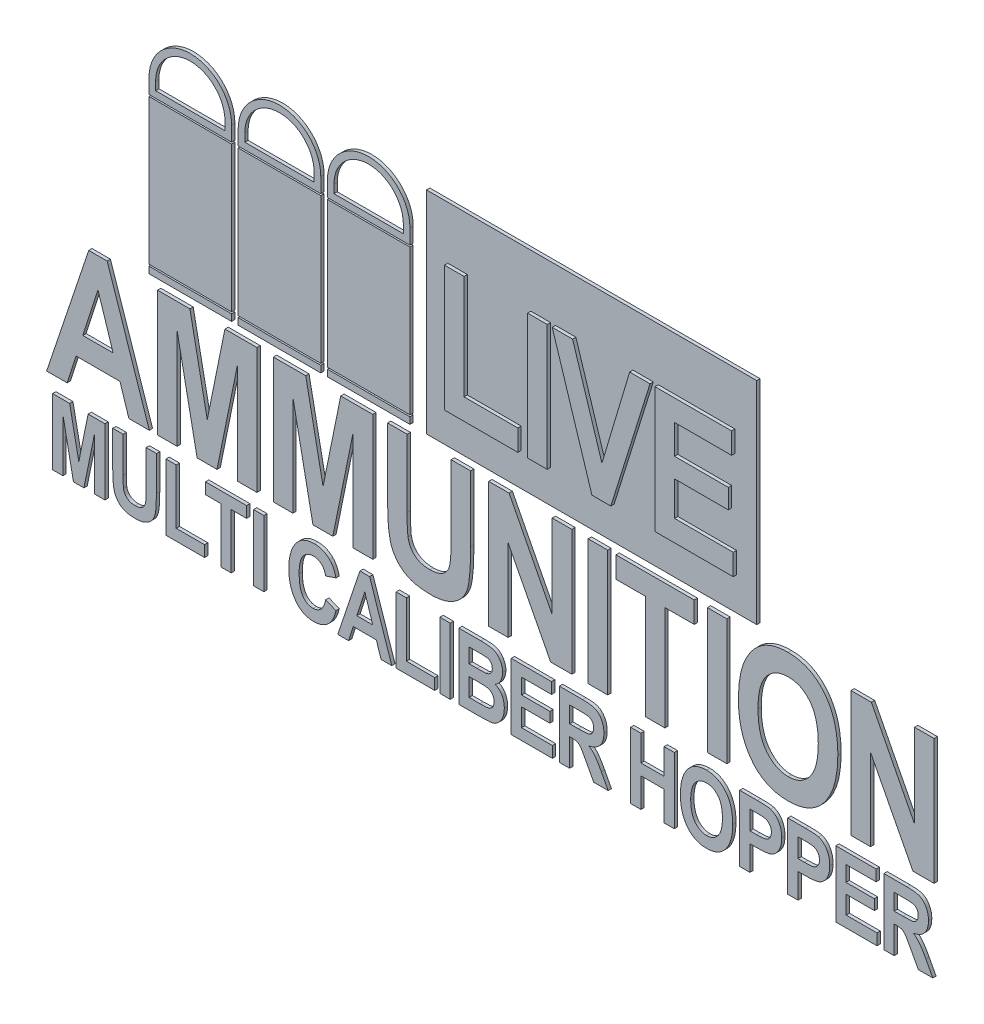
from build123d import *

# Parameters (mm, degrees)
BOSS_EXTRUDE1_DEPTH   = 1
SKETCH2_W             = 25
SKETCH2_H             = 44
BOSS_EXTRUDE1_2_DEPTH = 1
SKETCH2_H_2           = 2
BOSS_EXTRUDE1_3_DEPTH = 1
LPATTERN1_COUNT       = 3
LPATTERN1_PITCH       = 27
SKETCH3_W             = 100
SKETCH3_H             = 64
BOSS_EXTRUDE2_DEPTH   = 1
SKETCH4_W             = 5.922077922
SKETCH4_H             = 38
SKETCH4_W_2           = 3.116883117
SKETCH4_H_2           = 20
BOSS_EXTRUDE3_DEPTH   = 1
SCALE1_SCALE          = 0.6


with BuildPart() as part:
    # Sketch2 → Boss-Extrude1 (new body)
    with BuildSketch(Plane.XY):
        with BuildLine():
            ThreePointArc((-12.5, 51.5), (0, 64), (12.5, 51.5))
            Line((12.5, 51.5), (12.5, 47))
            Line((12.5, 47), (-12.5, 47))
            Line((-12.5, 47), (-12.5, 51.5))
        make_face()
        with BuildLine():
            ThreePointArc((10.5, 51.5), (0, 62), (-10.5, 51.5))
            Line((-10.5, 51.5), (-10.5, 49))
            Line((-10.5, 49), (10.5, 49))
            Line((10.5, 49), (10.5, 51.5))
        make_face(mode=Mode.SUBTRACT)
    extrude(amount=BOSS_EXTRUDE1_DEPTH)


with BuildPart() as body_2:
    # Sketch2 → Boss-Extrude1 2 (new body)
    with BuildSketch(Plane.XY):
        with Locations((0, 24.5)):
            Rectangle(SKETCH2_W, SKETCH2_H)
    extrude(amount=BOSS_EXTRUDE1_2_DEPTH)


with BuildPart() as body_3:
    # Sketch2 → Boss-Extrude1 3 (new body)
    with BuildSketch(Plane.XY):
        with Locations((0, 1)):
            Rectangle(SKETCH2_W, SKETCH2_H_2)
    extrude(amount=BOSS_EXTRUDE1_3_DEPTH)


with BuildPart() as lpattern1_1:
    # LPattern1: pattern copy
    add(body_3.part.moved(Location(Vector(1, 0, 0) * (1 * LPATTERN1_PITCH))))


with BuildPart() as lpattern1_2:
    # LPattern1: pattern copy
    add(body_3.part.moved(Location(Vector(1, 0, 0) * (2 * LPATTERN1_PITCH))))


with BuildPart() as lpattern1_3:
    # LPattern1: pattern copy
    add(body_2.part.moved(Location(Vector(1, 0, 0) * (1 * LPATTERN1_PITCH))))


with BuildPart() as lpattern1_4:
    # LPattern1: pattern copy
    add(body_2.part.moved(Location(Vector(1, 0, 0) * (2 * LPATTERN1_PITCH))))


with BuildPart() as lpattern1_5:
    # LPattern1: pattern copy
    add(part.part.moved(Location(Vector(1, 0, 0) * (1 * LPATTERN1_PITCH))))


with BuildPart() as lpattern1_6:
    # LPattern1: pattern copy
    add(part.part.moved(Location(Vector(1, 0, 0) * (2 * LPATTERN1_PITCH))))


with BuildPart() as body_10:
    # Sketch3 → Boss-Extrude2 (new body)
    with BuildSketch(Plane.XY):
        with Locations((121.5, 32)):
            Rectangle(SKETCH3_W, SKETCH3_H)
    extrude(amount=BOSS_EXTRUDE2_DEPTH)

    # Sketch4 → Boss-Extrude3 (add)
    # profile 1 of 32: a face of its own
    with BuildSketch(Plane.XY.offset(1)):
        Polygon((77.954545455, 10), (77.954545455, 48), (83.876623377, 48), (83.876623377, 16.415584416), (100.162337662, 16.415584416), (100.162337662, 10), align=None)
    # profile 2 of 32: a face of its own
    with BuildSketch(Plane.XY.offset(1)):
        with Locations((106.109090909, 29)):
            Rectangle(SKETCH4_W, SKETCH4_H)
    # profile 3 of 32: a face of its own
    with BuildSketch(Plane.XY.offset(1)):
        Polygon((122.596834416, 10), (110.575324675, 48), (116.736444805, 48), (125.627272727, 19.877840909), (134.024594156, 48), (140.185714286, 48), (128.318425325, 10), align=None)
    # profile 4 of 32: a face of its own
    with BuildSketch(Plane.XY.offset(1)):
        Polygon((141.690909091, 10), (141.690909091, 48), (164.885714286, 48), (164.885714286, 41.584415584), (147.612987013, 41.584415584), (147.612987013, 32.701298701), (163.898701299, 32.701298701), (163.898701299, 26.779220779), (147.612987013, 26.779220779), (147.612987013, 16.415584416), (165.379220779, 16.415584416), (165.379220779, 10), align=None)
    # profile 5 of 32: a face of its own
    with BuildSketch(Plane.XY.offset(1)):
        Polygon((-11.409090909, -40), (-17.593344156, -40), (-20.299918831, -31.61038961), (-33.601461039, -31.61038961), (-36.300324675, -40), (-42.5, -40), (-29.753652597, -2), (-24.178571429, -2), align=None)
        Polygon((-22.366477273, -25.194805195), (-26.954545455, -10.952516234), (-31.542613636, -25.194805195), align=None, mode=Mode.SUBTRACT)
    # profile 6 of 32: a face of its own
    with BuildSketch(Plane.XY.offset(1)):
        Polygon((-8.916883117, -40), (-8.916883117, -2), (0.883847403, -2), (6.135064935, -28.418019481), (11.486525974, -2), (21.187012987, -2), (21.187012987, -40), (15.264935065, -40), (15.264935065, -9.595373377), (9.088392857, -40), (3.066071429, -40), (-2.994805195, -9.595373377), (-2.994805195, -40), align=None)
    # profile 7 of 32: a face of its own
    with BuildSketch(Plane.XY.offset(1)):
        Polygon((26.146753247, -40), (26.146753247, -2), (35.947483766, -2), (41.198701299, -28.418019481), (46.550162338, -2), (56.250649351, -2), (56.250649351, -40), (50.328571429, -40), (50.328571429, -9.595373377), (44.152029221, -40), (38.129707792, -40), (32.068831169, -9.595373377), (32.068831169, -40), align=None)
    # profile 8 of 32: a face of its own
    with BuildSketch(Plane.XY.offset(1)):
        with BuildLine():
            Line((60.716883117, -2), (66.638961039, -2))
            Line((66.638961039, -2), (66.638961039, -22.573051948))
            add(Edge.make_bspline(
                [(66.638961039, -22.573051948), (66.642005268, -22.95602488), (66.647807706, -23.685988415), (66.648717001, -24.727180144), (66.678354301, -25.662591623), (66.695134236, -26.495778316), (66.73384583, -27.225945133), (66.783458622, -27.850035243), (66.821023479, -28.371076106), (66.871025542, -28.680416205), (66.893425325, -28.818993506)],
                knots=[0, 0, 0, 0, 1.469285763, 2.800524371, 3.994042537, 5.059414993, 5.997483402, 6.798392936, 7.46170747, 8, 8, 8, 8], degree=3))
            add(Edge.make_bspline(
                [(66.893425325, -28.818993506), (66.979166694, -29.219308088), (67.144643006, -29.991894068), (67.6229785, -31.047092181), (68.233530785, -31.972335327), (69.020403144, -32.735497922), (69.948723069, -33.349024699), (71.027563274, -33.76613137), (72.231423983, -34.038505141), (73.081187567, -34.064400163), (73.524918831, -34.077922078)],
                knots=[0, 0, 0, 0, 1.05227666, 2.030838329, 2.965952682, 3.893387552, 4.835862824, 5.813729276, 6.85836874, 8, 8, 8, 8], degree=3))
            add(Edge.make_bspline(
                [(73.524918831, -34.077922078), (73.901060524, -34.067332539), (74.622333142, -34.04702651), (75.647027209, -33.859382251), (76.567318217, -33.560638461), (77.376058468, -33.135217387), (78.069702434, -32.597051532), (78.652679687, -31.96315057), (79.109498325, -31.230292316), (79.392833188, -30.535103545), (79.564371344, -29.885872955), (79.665222592, -29.265772929), (79.756856213, -28.524945726), (79.83183982, -27.660643738), (79.891783079, -26.673301192), (79.939201793, -25.56278164), (79.959055079, -24.328672735), (79.962061626, -23.464965079), (79.963636364, -23.012581169)],
                knots=[0, 0, 0, 0, 1.210192899, 2.320612201, 3.341352725, 4.315073608, 5.247135226, 6.155185472, 7.073736358, 8.012826977, 8.56089637, 9.233084862, 10.033819608, 10.964483777, 12.025952736, 13.21881392, 14.543298968, 16, 16, 16, 16], degree=3))
            Line((79.963636364, -23.012581169), (79.963636364, -2))
            Line((79.963636364, -2), (85.885714286, -2))
            Line((85.885714286, -2), (85.885714286, -21.879058442))
            add(Edge.make_bspline(
                [(85.885714286, -21.879058442), (85.882438829, -22.490825448), (85.876107446, -23.67335683), (85.836780705, -25.380246628), (85.779321524, -26.95647441), (85.685997305, -28.398716052), (85.571199671, -29.709992942), (85.438795641, -30.889209268), (85.265945142, -31.935324958), (85.079448072, -32.86800006), (84.832463878, -33.715634463), (84.536453033, -34.51108676), (84.163275661, -35.260712571), (83.726685692, -35.97010385), (83.226943882, -36.639314775), (82.659215005, -37.269320059), (82.023848279, -37.853737777), (81.33147001, -38.402962905), (80.577099131, -38.896807533), (79.75992387, -39.322710924), (78.886855099, -39.683178856), (77.957314435, -39.9867974), (76.968848959, -40.216198039), (75.921991083, -40.374557352), (74.819922852, -40.478969111), (74.064940216, -40.488590107), (73.67913961, -40.493506494)],
                knots=[0, 0, 0, 0, 1.69941726, 3.284934, 4.742645532, 6.080601134, 7.299143691, 8.399121829, 9.375758488, 10.243985084, 11.039399806, 11.825790082, 12.59854505, 13.361473367, 14.136895684, 14.91546747, 15.713761241, 16.532267381, 17.368001279, 18.214343285, 19.088188771, 19.989122623, 20.927829205, 21.903342887, 22.928595776, 24, 24, 24, 24], degree=3))
            add(Edge.make_bspline(
                [(73.67913961, -40.493506494), (73.278067847, -40.486496923), (72.500878229, -40.472913905), (71.36761428, -40.399260152), (70.301789522, -40.259849097), (69.303098702, -40.067849734), (68.367697218, -39.832242428), (67.504464241, -39.530675085), (66.705231255, -39.178198563), (65.976985602, -38.762752512), (65.298434087, -38.310346173), (64.687387974, -37.792118638), (64.098087726, -37.258170701), (63.579000614, -36.658191563), (63.093513659, -36.023428335), (62.666615784, -35.339862185), (62.285101972, -34.612022446), (61.936037783, -33.827923432), (61.635393686, -32.931351819), (61.399421905, -31.883560243), (61.184474075, -30.674466021), (61.007837506, -29.297892075), (60.885740398, -27.756187935), (60.780721636, -26.049425521), (60.733603892, -24.174630707), (60.722614704, -22.868653409), (60.716883117, -22.1875)],
                knots=[0, 0, 0, 0, 1.101276875, 2.134034431, 3.11617034, 4.050409819, 4.925069176, 5.762018322, 6.55810086, 7.319651782, 8.061491943, 8.793396749, 9.517399564, 10.242364782, 10.96784505, 11.709920146, 12.451760307, 13.222767815, 14.064108867, 15.04322293, 16.168677574, 17.435293046, 18.851812183, 20.414137798, 22.129736046, 24, 24, 24, 24], degree=3))
            Line((60.716883117, -22.1875), (60.716883117, -2))
        make_face()
    # profile 9 of 32: a face of its own
    with BuildSketch(Plane.XY.offset(1)):
        Polygon((91.338961039, -40), (91.338961039, -2), (97.523214286, -2), (110.585714286, -27.377029221), (110.585714286, -2), (116.507792208, -2), (116.507792208, -40), (110.10762987, -40), (97.261038961, -15.216720779), (97.261038961, -40), align=None)
    # profile 10 of 32: a face of its own
    with BuildSketch(Plane.XY.offset(1)):
        with Locations((124.428571429, -21)):
            Rectangle(SKETCH4_W, SKETCH4_H)
    # profile 11 of 32: a face of its own
    with BuildSketch(Plane.XY.offset(1)):
        Polygon((138.764935065, -40), (138.764935065, -8.415584416), (129.881818182, -8.415584416), (129.881818182, -2), (153.57012987, -2), (153.57012987, -8.415584416), (144.687012987, -8.415584416), (144.687012987, -40), align=None)
    # profile 12 of 32: a face of its own
    with BuildSketch(Plane.XY.offset(1)):
        with Locations((160.503896104, -21)):
            Rectangle(SKETCH4_W, SKETCH4_H)
    # profile 13 of 32: a face of its own
    with BuildSketch(Plane.XY.offset(1)):
        with BuildLine():
            add(Edge.make_bspline(
                [(166.944155844, -21.231331169), (166.949720896, -20.681129056), (166.960599192, -19.605620325), (167.05581385, -18.03126164), (167.204498606, -16.530043966), (167.432851849, -15.105908144), (167.701991073, -13.751365116), (168.056290948, -12.477509773), (168.448242745, -11.269530004), (168.926254621, -10.144384545), (169.439959414, -9.084242464), (170.00365531, -8.100663001), (170.599182149, -7.18076565), (171.239243216, -6.33600329), (171.910642098, -5.552435624), (172.618949883, -4.839680533), (173.374229941, -4.206209489), (174.161185506, -3.630052553), (174.996023808, -3.129368388), (175.871890345, -2.697834091), (176.784890263, -2.323759432), (177.744649461, -2.023080047), (178.748561441, -1.795260613), (179.793620985, -1.623642542), (180.881109724, -1.522105827), (181.62061996, -1.511751091), (181.996103896, -1.506493506)],
                knots=[0, 0, 0, 0, 1.413007263, 2.762078904, 4.049593578, 5.285819603, 6.465306206, 7.594367978, 8.679938674, 9.724528792, 10.731323562, 11.704103677, 12.63428548, 13.544001443, 14.424033479, 15.282963126, 16.12148102, 16.953398054, 17.7855508, 18.618122424, 19.459105522, 20.317248336, 21.19802291, 22.101006911, 23.035792388, 24, 24, 24, 24], degree=3))
            add(Edge.make_bspline(
                [(181.996103896, -1.506493506), (182.539409951, -1.519914933), (183.605805093, -1.546258363), (185.164231285, -1.794797409), (186.648175118, -2.184234547), (188.054206649, -2.743573622), (189.379732994, -3.466776008), (190.628205424, -4.34465588), (191.800079091, -5.378422069), (192.884538285, -6.568039095), (193.874470835, -7.897637843), (194.722962641, -9.379369447), (195.451358558, -10.986335238), (196.031733973, -12.735627375), (196.497642609, -14.611622392), (196.810123654, -16.624668148), (197.020158968, -18.767045388), (197.03857345, -20.241204924), (197.048051948, -21)],
                knots=[0, 0, 0, 0, 0.939885583, 1.844797075, 2.724414307, 3.591141889, 4.457241096, 5.332435845, 6.227757785, 7.156796134, 8.114335849, 9.091188046, 10.106791572, 11.163484353, 12.277169456, 13.449020478, 14.686932687, 16, 16, 16, 16], degree=3))
            add(Edge.make_bspline(
                [(197.048051948, -21), (197.035422612, -21.766457516), (197.010792844, -23.261205268), (196.799524561, -25.438729004), (196.45720144, -27.488831812), (195.973219681, -29.40895746), (195.348255009, -31.201294064), (194.583284644, -32.864681486), (193.686500852, -34.408179477), (192.964286045, -35.332068659), (192.606493506, -35.789772727)],
                knots=[0, 0, 0, 0, 1.16723241, 2.276340154, 3.328694564, 4.330478862, 5.288855569, 6.215552891, 7.11596681, 8, 8, 8, 8], degree=3))
            add(Edge.make_bspline(
                [(192.606493506, -35.789772727), (192.275560927, -36.165528258), (191.622767781, -36.906738552), (190.506552036, -37.867095319), (189.308150815, -38.684019557), (188.014517476, -39.340140033), (186.640444662, -39.862241627), (185.176267028, -40.231004659), (183.624470151, -40.447598455), (182.562272323, -40.477976235), (182.019237013, -40.493506494)],
                knots=[0, 0, 0, 0, 1.001181491, 1.974917111, 2.938062765, 3.897505349, 4.871145834, 5.87433439, 6.913280131, 8, 8, 8, 8], degree=3))
            add(Edge.make_bspline(
                [(182.019237013, -40.493506494), (181.470862129, -40.482442515), (180.400114548, -40.460839177), (178.840896277, -40.226127593), (177.367960816, -39.870473729), (175.985658566, -39.358731025), (174.693640649, -38.698728547), (173.495572426, -37.888018562), (172.36741653, -36.948533387), (171.715868083, -36.210179145), (171.385714286, -35.836038961)],
                knots=[0, 0, 0, 0, 1.094964679, 2.13800963, 3.143281602, 4.118328618, 5.076193384, 6.03488399, 7.004232895, 8, 8, 8, 8], degree=3))
            add(Edge.make_bspline(
                [(171.385714286, -35.836038961), (171.028489925, -35.377984342), (170.310142443, -34.456875875), (169.408458999, -32.927164331), (168.643877382, -31.278640303), (168.021562144, -29.506180337), (167.534442829, -27.612626578), (167.193331096, -25.595578831), (166.981230873, -23.454086801), (166.9567261, -21.984954508), (166.944155844, -21.231331169)],
                knots=[0, 0, 0, 0, 0.894191496, 1.798142236, 2.728299874, 3.690218715, 4.688169272, 5.737002699, 6.839146352, 8, 8, 8, 8], degree=3))
        make_face()
        with BuildLine():
            add(Edge.make_bspline(
                [(172.866233766, -20.976866883), (172.872496762, -21.506619697), (172.884615622, -22.531688271), (173.009845747, -24.017875697), (173.213905598, -25.402210915), (173.506956335, -26.685759593), (173.874408223, -27.868176394), (174.319146344, -28.952525361), (174.862251856, -29.92747997), (175.480496318, -30.801637411), (176.158079203, -31.571693775), (176.879532593, -32.240394208), (177.639908387, -32.810385825), (178.442320761, -33.273887469), (179.286392364, -33.634375973), (180.167334093, -33.885943171), (181.08806308, -34.047160312), (181.715257057, -34.067542391), (182.034659091, -34.077922078)],
                knots=[0, 0, 0, 0, 1.417627784, 2.743101411, 3.988491279, 5.160055516, 6.263228156, 7.299411243, 8.291037632, 9.243541693, 10.159958133, 11.031397084, 11.872096295, 12.698114263, 13.505705719, 14.322185685, 15.145563694, 16, 16, 16, 16], degree=3))
            add(Edge.make_bspline(
                [(182.034659091, -34.077922078), (182.356469955, -34.066597115), (182.988039863, -34.04437131), (183.915803373, -33.89715601), (184.798418503, -33.641608058), (185.638476165, -33.282042057), (186.439873044, -32.827174525), (187.186794371, -32.254608164), (187.904124029, -31.597778906), (188.56685117, -30.828302442), (189.177512572, -29.960136874), (189.705794487, -28.97692399), (190.140758613, -27.882999814), (190.501402709, -26.682892747), (190.786832768, -25.376125758), (190.980418928, -23.96057147), (191.108112422, -22.439171068), (191.119891328, -21.38840247), (191.125974026, -20.845779221)],
                knots=[0, 0, 0, 0, 0.856067668, 1.680075595, 2.491590685, 3.294271314, 4.105930429, 4.936043877, 5.792521075, 6.689215603, 7.631993153, 8.611021133, 9.650955643, 10.758472718, 11.941436728, 13.205325589, 14.55681326, 16, 16, 16, 16], degree=3))
            add(Edge.make_bspline(
                [(191.125974026, -20.845779221), (191.118699505, -20.313547104), (191.104588963, -19.281165168), (190.992819724, -17.786639829), (190.788926836, -16.402280899), (190.527853767, -15.123034638), (190.169136175, -13.953257445), (189.745445794, -12.883469245), (189.22348102, -11.930191571), (188.635726611, -11.080356303), (187.97767492, -10.340832455), (187.27155094, -9.695250936), (186.521246447, -9.143737456), (185.721600339, -8.688640954), (184.864999398, -8.352054018), (183.96548447, -8.106005346), (183.017284398, -7.942746628), (182.366927339, -7.929066908), (182.034659091, -7.922077922)],
                knots=[0, 0, 0, 0, 1.432762357, 2.779159561, 4.030754787, 5.197882272, 6.290139775, 7.320663351, 8.289843535, 9.209309419, 10.096549751, 10.948805523, 11.780590523, 12.598531546, 13.418314419, 14.250962417, 15.106414475, 16, 16, 16, 16], degree=3))
            add(Edge.make_bspline(
                [(182.034659091, -7.922077922), (181.702343483, -7.928927758), (181.051893725, -7.942335114), (180.101911366, -8.107979492), (179.196704106, -8.348074177), (178.34025547, -8.700251037), (177.532699978, -9.150649289), (176.772622914, -9.702933956), (176.060420696, -10.356156604), (175.396667172, -11.106166569), (174.786784787, -11.957340183), (174.275052166, -12.931071506), (173.835118799, -14.004890361), (173.480960588, -15.190944249), (173.208527898, -16.483578156), (173.010866374, -17.884986172), (172.884103356, -19.393771726), (172.872329631, -20.436824566), (172.866233766, -20.976866883)],
                knots=[0, 0, 0, 0, 0.8855316, 1.733273432, 2.565029, 3.379994694, 4.196545506, 5.026376759, 5.880638503, 6.769561942, 7.694238421, 8.666748973, 9.69692367, 10.785897995, 11.964055288, 13.217943305, 14.559585586, 16, 16, 16, 16], degree=3))
        make_face(mode=Mode.SUBTRACT)
    # profile 14 of 32: a face of its own
    with BuildSketch(Plane.XY.offset(1)):
        Polygon((201.020779221, -40), (201.020779221, -2), (207.205032468, -2), (220.267532468, -27.377029221), (220.267532468, -2), (226.18961039, -2), (226.18961039, -40), (219.789448052, -40), (206.942857143, -15.216720779), (206.942857143, -40), align=None)
    # profile 15 of 32: a face of its own
    with BuildSketch(Plane.XY.offset(1)):
        Polygon((-40.681818182, -65), (-40.681818182, -45), (-35.523538961, -45), (-32.75974026, -58.904220779), (-29.943181818, -45), (-24.837662338, -45), (-24.837662338, -65), (-27.954545455, -65), (-27.954545455, -48.997564935), (-31.205357143, -65), (-34.375, -65), (-37.564935065, -48.997564935), (-37.564935065, -65), align=None)
    # profile 16 of 32: a face of its own
    with BuildSketch(Plane.XY.offset(1)):
        with BuildLine():
            Line((-22.487012987, -45), (-19.37012987, -45))
            Line((-19.37012987, -45), (-19.37012987, -55.827922078))
            add(Edge.make_bspline(
                [(-19.37012987, -55.827922078), (-19.368527644, -56.029486779), (-19.36547373, -56.413678113), (-19.364995153, -56.96167376), (-19.349396574, -57.453995591), (-19.34056503, -57.892514903), (-19.320190507, -58.276813228), (-19.29407851, -58.605281707), (-19.274307534, -58.87951374), (-19.247990658, -59.042324318), (-19.236201299, -59.11525974)],
                knots=[0, 0, 0, 0, 1.469285763, 2.800524371, 3.994042537, 5.059414993, 5.997483402, 6.798392936, 7.46170747, 8, 8, 8, 8], degree=3))
            add(Edge.make_bspline(
                [(-19.236201299, -59.11525974), (-19.191074262, -59.325951625), (-19.103981467, -59.732575825), (-18.852225944, -60.287943253), (-18.530882635, -60.77491333), (-18.116739288, -61.176577854), (-17.628149854, -61.499486684), (-17.06033922, -61.71901651), (-16.426728321, -61.862371127), (-15.979484329, -61.876000086), (-15.745941558, -61.883116883)],
                knots=[0, 0, 0, 0, 1.05227666, 2.030838329, 2.965952682, 3.893387552, 4.835862824, 5.813729276, 6.85836874, 8, 8, 8, 8], degree=3))
            add(Edge.make_bspline(
                [(-15.745941558, -61.883116883), (-15.547972247, -61.877543442), (-15.168355079, -61.866856058), (-14.629042412, -61.768095921), (-14.144678724, -61.610862348), (-13.71902596, -61.38695652), (-13.353950189, -61.103711333), (-13.047120055, -60.770079248), (-12.806689193, -60.384364377), (-12.657565581, -60.01847555), (-12.567282341, -59.67677524), (-12.514202737, -59.350406805), (-12.465974515, -58.96049775), (-12.426509459, -58.505601967), (-12.394960375, -57.985947996), (-12.370003157, -57.401464021), (-12.359554059, -56.751933019), (-12.357971667, -56.297350042), (-12.357142857, -56.059253247)],
                knots=[0, 0, 0, 0, 1.210192899, 2.320612201, 3.341352725, 4.315073608, 5.247135226, 6.155185472, 7.073736358, 8.012826977, 8.56089637, 9.233084862, 10.033819608, 10.964483777, 12.025952736, 13.21881392, 14.543298968, 16, 16, 16, 16], degree=3))
            Line((-12.357142857, -56.059253247), (-12.357142857, -45))
            Line((-12.357142857, -45), (-9.24025974, -45))
            Line((-9.24025974, -45), (-9.24025974, -55.462662338))
            add(Edge.make_bspline(
                [(-9.24025974, -55.462662338), (-9.241983665, -55.784644973), (-9.245315972, -56.407029911), (-9.266014256, -57.305392962), (-9.296255931, -58.134986531), (-9.345373941, -58.89406108), (-9.405793748, -59.584206812), (-9.47548008, -60.204846983), (-9.566454026, -60.755434189), (-9.664610379, -61.246315821), (-9.79460206, -61.692439191), (-9.950397242, -62.111098295), (-10.146806385, -62.505638195), (-10.376590579, -62.879002026), (-10.639612584, -63.231218303), (-10.938417257, -63.562800031), (-11.272820796, -63.870388304), (-11.637230412, -64.159454161), (-12.034267716, -64.419372386), (-12.464359959, -64.643532065), (-12.923869838, -64.833252029), (-13.413101767, -64.993051263), (-13.933346754, -65.113788441), (-14.484324584, -65.197135448), (-15.064360495, -65.252089006), (-15.461719777, -65.257152688), (-15.664772727, -65.25974026)],
                knots=[0, 0, 0, 0, 1.69941726, 3.284934, 4.742645532, 6.080601134, 7.299143691, 8.399121829, 9.375758488, 10.243985084, 11.039399806, 11.825790082, 12.59854505, 13.361473367, 14.136895684, 14.91546747, 15.713761241, 16.532267381, 17.368001279, 18.214343285, 19.088188771, 19.989122623, 20.927829205, 21.903342887, 22.928595776, 24, 24, 24, 24], degree=3))
            add(Edge.make_bspline(
                [(-15.664772727, -65.25974026), (-15.875863129, -65.256051012), (-16.284910296, -65.248902055), (-16.881365006, -65.210136922), (-17.442325405, -65.136762683), (-17.967952153, -65.035710387), (-18.460268724, -64.911706541), (-18.914601869, -64.752986887), (-19.335250809, -64.567472928), (-19.718537995, -64.348817112), (-20.075670371, -64.110708512), (-20.397273589, -63.837957178), (-20.707431614, -63.556931948), (-20.980635357, -63.241153454), (-21.236154807, -62.907067545), (-21.460837899, -62.547295887), (-21.661634642, -62.16422234), (-21.845352636, -61.751538648), (-22.003586372, -61.279658852), (-22.127782046, -60.728189602), (-22.240912483, -60.091824222), (-22.333879098, -59.367311619), (-22.398140734, -58.555888387), (-22.453413766, -57.65759238), (-22.478212579, -56.670858267), (-22.483996362, -55.983501794), (-22.487012987, -55.625)],
                knots=[0, 0, 0, 0, 1.101276875, 2.134034431, 3.11617034, 4.050409819, 4.925069176, 5.762018322, 6.55810086, 7.319651782, 8.061491943, 8.793396749, 9.517399564, 10.242364782, 10.96784505, 11.709920146, 12.451760307, 13.222767815, 14.064108867, 15.04322293, 16.168677574, 17.435293046, 18.851812183, 20.414137798, 22.129736046, 24, 24, 24, 24], degree=3))
            Line((-22.487012987, -55.625), (-22.487012987, -45))
        make_face()
    # profile 17 of 32: a face of its own
    with BuildSketch(Plane.XY.offset(1)):
        Polygon((-6.37012987, -65), (-6.37012987, -45), (-3.253246753, -45), (-3.253246753, -61.623376623), (5.318181818, -61.623376623), (5.318181818, -65), align=None)
    # profile 18 of 32: a face of its own
    with BuildSketch(Plane.XY.offset(1)):
        Polygon((10.266233766, -65), (10.266233766, -48.376623377), (5.590909091, -48.376623377), (5.590909091, -45), (18.058441558, -45), (18.058441558, -48.376623377), (13.383116883, -48.376623377), (13.383116883, -65), align=None)
    # profile 19 of 32: a face of its own
    with BuildSketch(Plane.XY.offset(1)):
        with Locations((21.707792208, -55)):
            Rectangle(SKETCH4_W_2, SKETCH4_H_2)
    # profile 20 of 32: a face of its own
    with BuildSketch(Plane.XY.offset(1)):
        with BuildLine():
            Line((41.993506494, -57.727272727), (45.11038961, -59.025974026))
            add(Edge.make_bspline(
                [(45.11038961, -59.025974026), (45.046017086, -59.287976769), (44.920584045, -59.798502048), (44.683282014, -60.528186163), (44.422158241, -61.205221886), (44.123417984, -61.825819594), (43.797303508, -62.395424008), (43.435056674, -62.90843001), (43.043492822, -63.36746422), (42.620384836, -63.77145407), (42.166418902, -64.11905505), (41.694341209, -64.428802809), (41.19196133, -64.682729997), (40.66631393, -64.897132435), (40.113266467, -65.056505014), (39.537020865, -65.176439479), (38.93510374, -65.245071571), (38.525059802, -65.254795688), (38.316558442, -65.25974026)],
                knots=[0, 0, 0, 0, 1.282586353, 2.499182829, 3.646034602, 4.730797578, 5.771318175, 6.763713287, 7.712684321, 8.6363956, 9.539720391, 10.428356747, 11.317388874, 12.212151588, 13.124116906, 14.050177375, 15.008543639, 16, 16, 16, 16], degree=3))
            add(Edge.make_bspline(
                [(38.316558442, -65.25974026), (38.054952707, -65.25385872), (37.542473254, -65.242336922), (36.794667251, -65.118365233), (36.083065416, -64.930011848), (35.408950462, -64.659535209), (34.77152303, -64.313808472), (34.177516978, -63.885575127), (33.613071702, -63.390777578), (33.284885649, -63.004981307), (33.117694805, -62.808441558)],
                knots=[0, 0, 0, 0, 1.053414494, 2.063614103, 3.046293227, 4.01520277, 4.983805463, 5.961130836, 6.961320097, 8, 8, 8, 8], degree=3))
            add(Edge.make_bspline(
                [(33.117694805, -62.808441558), (32.933918472, -62.565788569), (32.563684062, -62.076941693), (32.098875313, -61.27083406), (31.703546552, -60.404806886), (31.379989459, -59.478075235), (31.127793758, -58.489612397), (30.951476219, -57.438947125), (30.845592159, -56.326587627), (30.83175331, -55.56436007), (30.824675325, -55.174512987)],
                knots=[0, 0, 0, 0, 0.898140554, 1.809387162, 2.740718204, 3.705966939, 4.703925369, 5.74945803, 6.848943185, 8, 8, 8, 8], degree=3))
            add(Edge.make_bspline(
                [(30.824675325, -55.174512987), (30.831141577, -54.762974278), (30.843736751, -53.961365925), (30.957137214, -52.794300366), (31.130011356, -51.694035307), (31.387759532, -50.664660253), (31.710645895, -49.700264455), (32.109571065, -48.806861752), (32.572763224, -47.975108525), (32.950675079, -47.478357435), (33.137987013, -47.232142857)],
                knots=[0, 0, 0, 0, 1.171098873, 2.281104103, 3.334483992, 4.338438261, 5.297974877, 6.225356982, 7.120398547, 8, 8, 8, 8], degree=3))
            add(Edge.make_bspline(
                [(33.137987013, -47.232142857), (33.308056995, -47.033117197), (33.643228448, -46.640880312), (34.216116191, -46.132961103), (34.831577499, -45.701211685), (35.489389661, -45.347718588), (36.192496146, -45.072783195), (36.93745578, -44.878784495), (37.727251244, -44.764317491), (38.267477484, -44.748401562), (38.543831169, -44.74025974)],
                knots=[0, 0, 0, 0, 1.017460211, 2.005195831, 2.96880208, 3.936538458, 4.903086366, 5.898753713, 6.925103759, 8, 8, 8, 8], degree=3))
            add(Edge.make_bspline(
                [(38.543831169, -44.74025974), (38.769989299, -44.745673133), (39.214492494, -44.756312903), (39.866275827, -44.841372036), (40.487259698, -44.990936629), (41.083505813, -45.187118704), (41.64978302, -45.449608296), (42.18772873, -45.768124098), (42.699458431, -46.141618933), (43.009625897, -46.431976315), (43.166396104, -46.578733766)],
                knots=[0, 0, 0, 0, 1.062174293, 2.087653736, 3.080296642, 4.058948008, 5.03139012, 6.005719887, 6.992016441, 8, 8, 8, 8], degree=3))
            add(Edge.make_bspline(
                [(43.166396104, -46.578733766), (43.275396908, -46.691842379), (43.497509893, -46.922325921), (43.796585526, -47.310561054), (44.073477671, -47.738126813), (44.323221946, -48.20684785), (44.555401265, -48.712142943), (44.766525882, -49.256602198), (44.952256724, -49.841464252), (45.056864333, -50.247027952), (45.11038961, -50.454545455)],
                knots=[0, 0, 0, 0, 0.858002413, 1.748367619, 2.673305357, 3.63929672, 4.648357542, 5.711115493, 6.828831091, 8, 8, 8, 8], degree=3))
            Line((45.11038961, -50.454545455), (41.993506494, -51.493506494))
            add(Edge.make_bspline(
                [(41.993506494, -51.493506494), (41.964217311, -51.360481965), (41.907225426, -51.101638325), (41.792800213, -50.728091731), (41.653492093, -50.381141178), (41.501923031, -50.052457631), (41.319408652, -49.753409739), (41.128492863, -49.469708813), (40.904626224, -49.218360794), (40.668117319, -48.986158327), (40.410623807, -48.785496906), (40.147056053, -48.604029957), (39.86955609, -48.45315349), (39.579281445, -48.331810882), (39.279670171, -48.233608034), (38.968489703, -48.164549379), (38.64645219, -48.122729801), (38.427616833, -48.118851397), (38.316558442, -48.116883117)],
                knots=[0, 0, 0, 0, 1.200071046, 2.335138942, 3.437621639, 4.493482591, 5.51985659, 6.521917265, 7.50210956, 8.480124453, 9.438987346, 10.374745328, 11.297656865, 12.216555725, 13.143999084, 14.072438006, 15.021767148, 16, 16, 16, 16], degree=3))
            add(Edge.make_bspline(
                [(38.316558442, -48.116883117), (38.159383255, -48.121543184), (37.85004641, -48.130714674), (37.396841297, -48.20368492), (36.968047692, -48.332748927), (36.55720995, -48.502184538), (36.171231695, -48.727923241), (35.80581607, -49.001295987), (35.470788717, -49.330564292), (35.149700343, -49.700934631), (34.858739943, -50.130055208), (34.611694701, -50.626004487), (34.407927219, -51.187011929), (34.232405562, -51.809054022), (34.101083086, -52.496217661), (34.009949325, -53.247438711), (33.953071589, -54.061627783), (33.945484413, -54.626525703), (33.941558442, -54.918831169)],
                knots=[0, 0, 0, 0, 0.827686898, 1.628972485, 2.409099021, 3.181967192, 3.964173723, 4.757978677, 5.579415306, 6.433460257, 7.33665582, 8.302235029, 9.343905073, 10.476376866, 11.703364719, 13.024698166, 14.460435141, 16, 16, 16, 16], degree=3))
            add(Edge.make_bspline(
                [(33.941558442, -54.918831169), (33.94599459, -55.221917427), (33.954537267, -55.805569769), (34.0043342, -56.64855939), (34.098986357, -57.423073772), (34.220148308, -58.13215835), (34.385947085, -58.771668476), (34.588502309, -59.34199582), (34.82181371, -59.848708295), (35.100129186, -60.285157743), (35.408508251, -60.661943558), (35.736371582, -60.989075735), (36.090048964, -61.262349154), (36.460078593, -61.493946806), (36.856619278, -61.669445361), (37.274979773, -61.788850643), (37.712678935, -61.871437488), (38.013132042, -61.879171625), (38.166396104, -61.883116883)],
                knots=[0, 0, 0, 0, 1.588381619, 3.058741945, 4.422565575, 5.675514383, 6.825848758, 7.879737597, 8.8437938, 9.742560847, 10.584031071, 11.391113559, 12.163968987, 12.921455088, 13.673648094, 14.427376256, 15.197789283, 16, 16, 16, 16], degree=3))
            add(Edge.make_bspline(
                [(38.166396104, -61.883116883), (38.27880236, -61.879635595), (38.50178487, -61.872729694), (38.829905572, -61.828754926), (39.146536546, -61.750128862), (39.451720496, -61.641044111), (39.744156736, -61.497120725), (40.026845662, -61.326613302), (40.294076611, -61.121661526), (40.552783585, -60.88894886), (40.796790941, -60.621288163), (41.019795015, -60.313553752), (41.226991002, -59.971245633), (41.417126309, -59.592240851), (41.591413566, -59.178975344), (41.74508369, -58.728277798), (41.884140881, -58.242398321), (41.956349111, -57.902288606), (41.993506494, -57.727272727)],
                knots=[0, 0, 0, 0, 0.874040642, 1.73385169, 2.568061146, 3.406503852, 4.248567505, 5.09821747, 5.96915136, 6.862782357, 7.800986125, 8.779254107, 9.812897901, 10.908933612, 12.073249979, 13.297367906, 14.609261928, 16, 16, 16, 16], degree=3))
        make_face()
    # profile 21 of 32: a face of its own
    with BuildSketch(Plane.XY.offset(1)):
        Polygon((62.006493506, -65), (58.751623377, -65), (57.32711039, -60.584415584), (50.326298701, -60.584415584), (48.905844156, -65), (45.642857143, -65), (52.351461039, -45), (55.285714286, -45), align=None)
        Polygon((56.239448052, -57.207792208), (53.824675325, -49.711850649), (51.409902597, -57.207792208), align=None, mode=Mode.SUBTRACT)
    # profile 22 of 32: a face of its own
    with BuildSketch(Plane.XY.offset(1)):
        Polygon((63.318181818, -65), (63.318181818, -45), (66.435064935, -45), (66.435064935, -61.623376623), (75.006493506, -61.623376623), (75.006493506, -65), align=None)
    # profile 23 of 32: a face of its own
    with BuildSketch(Plane.XY.offset(1)):
        with Locations((78.136363636, -55)):
            Rectangle(SKETCH4_W_2, SKETCH4_H_2)
    # profile 24 of 32: a face of its own
    with BuildSketch(Plane.XY.offset(1)):
        with BuildLine():
            Line((82.305194805, -45), (89.025974026, -45))
            add(Edge.make_bspline(
                [(89.025974026, -45), (89.246486856, -45.001979094), (89.671375018, -45.005792449), (90.283363515, -45.022942294), (90.843559153, -45.064915478), (91.352364347, -45.117730666), (91.81142169, -45.178005755), (92.218305297, -45.265796747), (92.576700134, -45.358995334), (92.985258398, -45.51197481), (93.446435374, -45.757607299), (93.941882448, -46.148338911), (94.398007731, -46.624654683), (94.795214712, -47.188674851), (95.134513798, -47.813993161), (95.378905842, -48.491992541), (95.524511357, -49.213231696), (95.54267107, -49.707113533), (95.551948052, -49.959415584)],
                knots=[0, 0, 0, 0, 1.124473672, 2.166656478, 3.121089245, 3.988001344, 4.77526076, 5.480116183, 6.109319004, 6.661554265, 7.701543192, 8.758483104, 9.865986798, 11.052779462, 12.265628083, 13.483214642, 14.714287386, 16, 16, 16, 16], degree=3))
            add(Edge.make_bspline(
                [(95.551948052, -49.959415584), (95.54367002, -50.191179268), (95.527399314, -50.646717356), (95.413331771, -51.313094629), (95.216317618, -51.944149247), (94.945820623, -52.532269047), (94.615732902, -53.068128451), (94.231161635, -53.533705508), (93.805207759, -53.933370719), (93.48043663, -54.13381502), (93.319805195, -54.232954545)],
                knots=[0, 0, 0, 0, 1.102195328, 2.166396157, 3.204342149, 4.237991037, 5.237902837, 6.188656202, 7.104111395, 8, 8, 8, 8], degree=3))
            add(Edge.make_bspline(
                [(93.319805195, -54.232954545), (93.52651275, -54.328947156), (93.938022037, -54.520047336), (94.488876601, -54.929169314), (94.958365564, -55.439595642), (95.362123394, -56.030008497), (95.683355376, -56.703125248), (95.908381355, -57.451744625), (96.049097168, -58.267166222), (96.063827672, -58.8346269), (96.071428571, -59.127435065)],
                knots=[0, 0, 0, 0, 0.914365049, 1.820299747, 2.735925076, 3.690630122, 4.685376883, 5.720815912, 6.823947219, 8, 8, 8, 8], degree=3))
            add(Edge.make_bspline(
                [(96.071428571, -59.127435065), (96.068315789, -59.308801027), (96.062217894, -59.664094278), (96.014187695, -60.186689093), (95.926253353, -60.686048116), (95.816850896, -61.16676368), (95.662712752, -61.622080171), (95.486362299, -62.05989616), (95.269545126, -62.474429939), (95.022586017, -62.864658196), (94.758378908, -63.228199259), (94.475081094, -63.554328375), (94.185536691, -63.848618986), (93.877368474, -64.101019214), (93.561131351, -64.321918741), (93.231669935, -64.506301766), (92.887604966, -64.649458547), (92.650887132, -64.718097829), (92.532467532, -64.752435065)],
                knots=[0, 0, 0, 0, 1.22020471, 2.390363083, 3.526102761, 4.629955915, 5.703561803, 6.756598922, 7.802848293, 8.845806378, 9.861642828, 10.823224211, 11.750015592, 12.6357154, 13.499202288, 14.342595175, 15.170872714, 16, 16, 16, 16], degree=3))
            add(Edge.make_bspline(
                [(92.532467532, -64.752435065), (92.435233976, -64.772300419), (92.214830148, -64.817330141), (91.84099628, -64.868887831), (91.385582578, -64.905152859), (90.848728539, -64.944630455), (90.227326669, -64.96443347), (89.523941707, -64.986443943), (88.73785918, -64.997824474), (88.187231441, -64.999250327), (87.897727273, -65)],
                knots=[0, 0, 0, 0, 0.512375785, 1.161426047, 1.946914314, 2.871141027, 3.940743941, 5.156722563, 6.50508681, 8, 8, 8, 8], degree=3))
            Line((87.897727273, -65), (82.305194805, -65))
            Line((82.305194805, -65), (82.305194805, -45))
        make_face()
        with BuildLine():
            Line((85.422077922, -48.376623377), (85.422077922, -52.792207792))
            Line((85.422077922, -52.792207792), (87.808441558, -52.792207792))
            add(Edge.make_bspline(
                [(87.808441558, -52.792207792), (87.978898807, -52.792665848), (88.303585214, -52.793538351), (88.764872879, -52.787693957), (89.174839093, -52.785900216), (89.531914747, -52.77586108), (89.837807351, -52.770152775), (90.091996536, -52.756196812), (90.296659307, -52.746899007), (90.41535686, -52.733200482), (90.466720779, -52.727272727)],
                knots=[0, 0, 0, 0, 1.537921726, 2.929428249, 4.162267198, 5.236648627, 6.152403654, 6.922235861, 7.533619789, 8, 8, 8, 8], degree=3))
            add(Edge.make_bspline(
                [(90.466720779, -52.727272727), (90.613830839, -52.700389076), (90.895821351, -52.648856674), (91.290079124, -52.505980404), (91.629857281, -52.304919745), (91.922916667, -52.054686602), (92.150162304, -51.745138822), (92.321914981, -51.388665541), (92.418208162, -50.978986861), (92.429282863, -50.690428362), (92.435064935, -50.539772727)],
                knots=[0, 0, 0, 0, 1.100193615, 2.108925541, 3.069258182, 3.994366649, 4.926956476, 5.876216083, 6.891177988, 8, 8, 8, 8], degree=3))
            add(Edge.make_bspline(
                [(92.435064935, -50.539772727), (92.429470523, -50.404114561), (92.418797315, -50.14530137), (92.341830799, -49.77535344), (92.207544401, -49.445966586), (92.018651646, -49.161501967), (91.795130799, -48.921648277), (91.54650999, -48.727749039), (91.272461546, -48.586460934), (91.016821968, -48.510218498), (90.769548215, -48.467681009), (90.512791123, -48.44833053), (90.187143136, -48.420474179), (89.78892695, -48.409298044), (89.319703169, -48.389239278), (88.779737412, -48.38565102), (88.169685103, -48.373922117), (87.73945642, -48.375689633), (87.512175325, -48.376623377)],
                knots=[0, 0, 0, 0, 1.052351386, 2.007711197, 2.916182618, 3.795496935, 4.642249233, 5.450649971, 6.230038409, 7.020378978, 7.510527392, 8.174883014, 9.017067762, 10.046711282, 11.265182827, 12.661551488, 14.236365296, 16, 16, 16, 16], degree=3))
            Line((87.512175325, -48.376623377), (85.422077922, -48.376623377))
        make_face(mode=Mode.SUBTRACT)
        with BuildLine():
            Line((85.422077922, -56.168831169), (85.422077922, -61.623376623))
            Line((85.422077922, -61.623376623), (88.717532468, -61.623376623))
            add(Edge.make_bspline(
                [(88.717532468, -61.623376623), (88.890692603, -61.622254456), (89.220797645, -61.620115205), (89.690343844, -61.613495441), (90.111165589, -61.597184576), (90.483506372, -61.574396327), (90.808040193, -61.540725048), (91.083696079, -61.507710089), (91.309585468, -61.461912494), (91.548180087, -61.400599259), (91.803884066, -61.281292186), (92.07824562, -61.093325379), (92.326170059, -60.850590268), (92.547182164, -60.561020474), (92.73305637, -60.22189849), (92.859215406, -59.835165475), (92.944724427, -59.408497048), (92.951181706, -59.108958668), (92.954545455, -58.952922078)],
                knots=[0, 0, 0, 0, 1.422074328, 2.710981391, 3.856134465, 4.880390511, 5.773592636, 6.5356346, 7.158764273, 7.665440749, 8.555459036, 9.45835037, 10.38545437, 11.392024878, 12.440928025, 13.544085548, 14.72065637, 16, 16, 16, 16], degree=3))
            add(Edge.make_bspline(
                [(92.954545455, -58.952922078), (92.949070743, -58.792978521), (92.938554561, -58.485748522), (92.859184448, -58.045259752), (92.715466986, -57.651225285), (92.519243145, -57.301435433), (92.275193052, -57.002132165), (91.994491356, -56.747954942), (91.674485328, -56.547615264), (91.373831437, -56.424142606), (91.096708306, -56.348042485), (90.838089851, -56.30379505), (90.532865596, -56.256099934), (90.178739493, -56.228541574), (89.777262939, -56.196686824), (89.326319735, -56.184835307), (88.827202367, -56.170341565), (88.478100579, -56.169349964), (88.295454545, -56.168831169)],
                knots=[0, 0, 0, 0, 1.220775758, 2.344945564, 3.400211975, 4.408337778, 5.392209119, 6.335627291, 7.286926182, 8.259293687, 8.805475582, 9.477947255, 10.260788822, 11.163063353, 12.188028698, 13.335114355, 14.605762531, 16, 16, 16, 16], degree=3))
            Line((88.295454545, -56.168831169), (85.422077922, -56.168831169))
        make_face(mode=Mode.SUBTRACT)
    # profile 25 of 32: a face of its own
    with BuildSketch(Plane.XY.offset(1)):
        Polygon((98.162337662, -65), (98.162337662, -45), (110.37012987, -45), (110.37012987, -48.376623377), (101.279220779, -48.376623377), (101.279220779, -53.051948052), (109.850649351, -53.051948052), (109.850649351, -56.168831169), (101.279220779, -56.168831169), (101.279220779, -61.623376623), (110.62987013, -61.623376623), (110.62987013, -65), align=None)
    # profile 26 of 32: a face of its own
    with BuildSketch(Plane.XY.offset(1)):
        with BuildLine():
            Line((112.720779221, -65), (112.720779221, -45))
            Line((112.720779221, -45), (119.741883117, -45))
            add(Edge.make_bspline(
                [(119.741883117, -45), (119.958345859, -45.001583477), (120.375185456, -45.004632758), (120.977751742, -45.027094145), (121.531013608, -45.073603266), (122.038099791, -45.127155264), (122.494677337, -45.203742954), (122.90407588, -45.296889851), (123.265746106, -45.404411948), (123.685222177, -45.57162186), (124.155233388, -45.848312624), (124.66067212, -46.272614367), (125.110323531, -46.798227967), (125.505023887, -47.412967699), (125.830849559, -48.110513556), (126.059323183, -48.88326837), (126.206112919, -49.719801718), (126.220075172, -50.301027114), (126.227272727, -50.600649351)],
                knots=[0, 0, 0, 0, 1.04688713, 2.015977467, 2.915189129, 3.731617614, 4.481301739, 5.152637087, 5.761127871, 6.304197559, 7.333207252, 8.382830279, 9.482073253, 10.665313535, 11.906396088, 13.191683403, 14.552310161, 16, 16, 16, 16], degree=3))
            add(Edge.make_bspline(
                [(126.227272727, -50.600649351), (126.22281873, -50.791505618), (126.214114654, -51.16448012), (126.162480811, -51.710205212), (126.07033118, -52.227943854), (125.934055692, -52.715346953), (125.770136175, -53.177939651), (125.561155366, -53.609233413), (125.317173742, -54.013269692), (125.036741729, -54.386838617), (124.722952546, -54.729677909), (124.375928959, -55.0390946), (123.997994737, -55.317310611), (123.584195343, -55.554324244), (123.145590962, -55.769074904), (122.671358964, -55.941303604), (122.166968594, -56.085327519), (121.816383712, -56.15132766), (121.637175325, -56.185064935)],
                knots=[0, 0, 0, 0, 1.148725412, 2.24485837, 3.2956961, 4.308991144, 5.287710444, 6.245445092, 7.187969991, 8.124285181, 9.052065607, 9.980417459, 10.918430283, 11.870785624, 12.846723983, 13.853982378, 14.9030207, 16, 16, 16, 16], degree=3))
            add(Edge.make_bspline(
                [(121.637175325, -56.185064935), (121.814835251, -56.311194972), (122.162449887, -56.557984711), (122.643598665, -56.961444541), (123.074011093, -57.384304922), (123.403724405, -57.758478138), (123.652466626, -58.09258735), (123.859564049, -58.383930265), (124.081862255, -58.721592943), (124.322240363, -59.104005437), (124.576229012, -59.533983842), (124.848156924, -60.008871758), (125.136723379, -60.530276309), (125.333386831, -60.894034066), (125.435876623, -61.083603896)],
                knots=[0, 0, 0, 0, 1.250008602, 2.445803593, 3.598666354, 4.710220312, 5.303348366, 5.98833631, 6.761333787, 7.622934579, 8.580231874, 9.626942586, 10.763297605, 12, 12, 12, 12], degree=3))
            Line((125.435876623, -61.083603896), (127.525974026, -65))
            Line((127.525974026, -65), (123.146915584, -65))
            Line((123.146915584, -65), (120.829545455, -60.673701299))
            add(Edge.make_bspline(
                [(120.829545455, -60.673701299), (120.729818704, -60.486807771), (120.5400248, -60.131123344), (120.263344625, -59.626872469), (120.011894057, -59.178404524), (119.7896927, -58.781189756), (119.586420458, -58.443390054), (119.412909353, -58.155533705), (119.259725469, -57.926409844), (119.094423698, -57.694925375), (118.901396173, -57.462077606), (118.659986801, -57.232242144), (118.413069374, -57.047136249), (118.146715816, -56.905230469), (117.838348483, -56.798552357), (117.462933157, -56.738379885), (117.013117653, -56.690830772), (116.687408551, -56.689195531), (116.511363636, -56.688311688)],
                knots=[0, 0, 0, 0, 1.60136501, 3.047620763, 4.347844099, 5.488187185, 6.487883687, 7.328020115, 8.028596314, 8.570701125, 9.478104161, 10.309984134, 11.085182614, 11.803449194, 12.582885785, 13.539658025, 14.670191624, 16, 16, 16, 16], degree=3))
            Line((116.511363636, -56.688311688), (115.837662338, -56.688311688))
            Line((115.837662338, -56.688311688), (115.837662338, -65))
            Line((115.837662338, -65), (112.720779221, -65))
        make_face()
        with BuildLine():
            Line((115.837662338, -53.311688312), (118.504058442, -53.311688312))
            add(Edge.make_bspline(
                [(118.504058442, -53.311688312), (118.698863097, -53.310547712), (119.069549635, -53.308377308), (119.597259977, -53.302005909), (120.069383946, -53.284787112), (120.484787262, -53.265281492), (120.846246541, -53.241798498), (121.151257405, -53.211739544), (121.401674582, -53.170735454), (121.660361341, -53.114310992), (121.934629541, -53.010082537), (122.223025562, -52.834899688), (122.484246452, -52.617802313), (122.707558591, -52.346719017), (122.893390934, -52.027606055), (123.020895155, -51.656907534), (123.099577183, -51.239802567), (123.10666152, -50.946005206), (123.11038961, -50.791396104)],
                knots=[0, 0, 0, 0, 1.530151125, 2.911667714, 4.144992328, 5.240737814, 6.177978559, 6.99000054, 7.646825852, 8.170085487, 9.068012172, 9.935431023, 10.810237812, 11.723128894, 12.67998143, 13.694953287, 14.786982971, 16, 16, 16, 16], degree=3))
            add(Edge.make_bspline(
                [(123.11038961, -50.791396104), (123.106462529, -50.643577018), (123.098944368, -50.360586258), (123.021830461, -49.959077414), (122.892155842, -49.602566316), (122.706907859, -49.294166565), (122.477123594, -49.033635362), (122.21143683, -48.812587344), (121.907024057, -48.636311349), (121.682049391, -48.56089708), (121.568181818, -48.522727273)],
                knots=[0, 0, 0, 0, 1.194031269, 2.285901139, 3.289564975, 4.246236721, 5.176404817, 6.085300565, 7.030903425, 8, 8, 8, 8], degree=3))
            add(Edge.make_bspline(
                [(121.568181818, -48.522727273), (121.516877064, -48.511387895), (121.394757391, -48.484397003), (121.179430302, -48.452746134), (120.902845952, -48.431131959), (120.567282858, -48.410910008), (120.172170033, -48.395549184), (119.71761906, -48.382211275), (119.203454102, -48.38113592), (118.840905607, -48.378179043), (118.650162338, -48.376623377)],
                knots=[0, 0, 0, 0, 0.430892152, 1.025643899, 1.783105936, 2.70574662, 3.782977, 5.026178935, 6.435419374, 8, 8, 8, 8], degree=3))
            Line((118.650162338, -48.376623377), (115.837662338, -48.376623377))
            Line((115.837662338, -48.376623377), (115.837662338, -53.311688312))
        make_face(mode=Mode.SUBTRACT)
    # profile 27 of 32: a face of its own
    with BuildSketch(Plane.XY.offset(1)):
        Polygon((134.305194805, -65), (134.305194805, -45), (137.422077922, -45), (137.422077922, -52.792207792), (144.435064935, -52.792207792), (144.435064935, -45), (147.551948052, -45), (147.551948052, -65), (144.435064935, -65), (144.435064935, -56.168831169), (137.422077922, -56.168831169), (137.422077922, -65), align=None)
    # profile 28 of 32: a face of its own
    with BuildSketch(Plane.XY.offset(1)):
        with BuildLine():
            add(Edge.make_bspline(
                [(149.383116883, -55.121753247), (149.386045858, -54.832173187), (149.391771277, -54.26611596), (149.441884254, -53.437506126), (149.520139389, -52.647391561), (149.640325307, -51.897846391), (149.78197753, -51.184929009), (149.968451148, -50.514478828), (150.174741568, -49.878700002), (150.426326766, -49.286518182), (150.69669771, -48.728548665), (150.99337976, -48.210875264), (151.306814938, -47.726718763), (151.643689184, -47.282106995), (151.997057017, -46.86970296), (152.369850588, -46.494568702), (152.767366408, -46.161162889), (153.181553547, -45.857922396), (153.620942127, -45.594404415), (154.081924515, -45.3672811), (154.562450788, -45.170399701), (155.067587208, -45.012147393), (155.595961934, -44.892242428), (156.145993273, -44.801917127), (156.718355767, -44.748476751), (157.107571681, -44.74302689), (157.305194805, -44.74025974)],
                knots=[0, 0, 0, 0, 1.413007263, 2.762078904, 4.049593578, 5.285819603, 6.465306206, 7.594367978, 8.679938674, 9.724528792, 10.731323562, 11.704103677, 12.63428548, 13.544001443, 14.424033479, 15.282963126, 16.12148102, 16.953398054, 17.7855508, 18.618122424, 19.459105522, 20.317248336, 21.19802291, 22.101006911, 23.035792388, 24, 24, 24, 24], degree=3))
            add(Edge.make_bspline(
                [(157.305194805, -44.74025974), (157.59114536, -44.747323649), (158.152405961, -44.761188612), (158.972630273, -44.891998636), (159.753653343, -45.096965551), (160.493669938, -45.391354538), (161.191315383, -45.771987373), (161.848406136, -46.234029411), (162.46518175, -46.778116878), (163.035949747, -47.404231103), (163.556966878, -48.104019917), (164.003541513, -48.883878656), (164.386907785, -49.729650125), (164.69236853, -50.650330197), (164.937583602, -51.637695996), (165.102047309, -52.697193762), (165.212592211, -53.824760731), (165.222284044, -54.60063417), (165.227272727, -55)],
                knots=[0, 0, 0, 0, 0.939885583, 1.844797075, 2.724414307, 3.591141889, 4.457241096, 5.332435845, 6.227757785, 7.156796134, 8.114335849, 9.091188046, 10.106791572, 11.163484353, 12.277169456, 13.449020478, 14.686932687, 16, 16, 16, 16], degree=3))
            add(Edge.make_bspline(
                [(165.227272727, -55), (165.220625708, -55.403398693), (165.207662672, -56.190108036), (165.096468839, -57.33617316), (164.916298776, -58.415174638), (164.661571534, -59.425767084), (164.33264276, -60.369102139), (163.930026778, -61.244569203), (163.458035308, -62.056936567), (163.077922252, -62.543194031), (162.88961039, -62.784090909)],
                knots=[0, 0, 0, 0, 1.16723241, 2.276340154, 3.328694564, 4.330478862, 5.288855569, 6.215552891, 7.11596681, 8, 8, 8, 8], degree=3))
            add(Edge.make_bspline(
                [(162.88961039, -62.784090909), (162.715435348, -62.981856978), (162.371860008, -63.371967659), (161.784378036, -63.877418589), (161.153640552, -64.307378714), (160.4727809, -64.652705281), (159.749584682, -64.927495593), (158.978964874, -65.1215814), (158.162229676, -65.235578134), (157.603178188, -65.251566439), (157.31737013, -65.25974026)],
                knots=[0, 0, 0, 0, 1.001181491, 1.974917111, 2.938062765, 3.897505349, 4.871145834, 5.87433439, 6.913280131, 8, 8, 8, 8], degree=3))
            add(Edge.make_bspline(
                [(157.31737013, -65.25974026), (157.02875177, -65.253917113), (156.465200411, -65.242546935), (155.644559216, -65.119014523), (154.869330026, -64.931828278), (154.141802526, -64.662490013), (153.461793096, -64.315120288), (152.831230873, -63.888430822), (152.237464613, -63.393964941), (151.894544377, -63.005357445), (151.720779221, -62.808441558)],
                knots=[0, 0, 0, 0, 1.094964679, 2.13800963, 3.143281602, 4.118328618, 5.076193384, 6.03488399, 7.004232895, 8, 8, 8, 8], degree=3))
            add(Edge.make_bspline(
                [(151.720779221, -62.808441558), (151.5327664, -62.56736018), (151.154688777, -62.08256625), (150.680118543, -61.277454911), (150.277707166, -60.409810686), (149.95017283, -59.476937019), (149.693794243, -58.480329778), (149.514261752, -57.4187257), (149.402630056, -56.291624632), (149.389732807, -55.518397109), (149.383116883, -55.121753247)],
                knots=[0, 0, 0, 0, 0.894191496, 1.798142236, 2.728299874, 3.690218715, 4.688169272, 5.737002699, 6.839146352, 8, 8, 8, 8], degree=3))
        make_face()
        with BuildLine():
            add(Edge.make_bspline(
                [(152.5, -54.987824675), (152.503296314, -55.266641946), (152.509674661, -55.806151722), (152.575585253, -56.58835563), (152.682985175, -57.316953113), (152.837222405, -57.992505049), (153.030618135, -58.614829681), (153.26469083, -59.185539664), (153.550535837, -59.698673669), (153.875927659, -60.158756532), (154.23255023, -60.564049355), (154.612262541, -60.915996951), (155.012460327, -61.21599254), (155.434782629, -61.459940773), (155.879030841, -61.649671565), (156.342684382, -61.782075353), (156.827278586, -61.86692648), (157.157380679, -61.87765389), (157.325487013, -61.883116883)],
                knots=[0, 0, 0, 0, 1.417627784, 2.743101411, 3.988491279, 5.160055516, 6.263228156, 7.299411243, 8.291037632, 9.243541693, 10.159958133, 11.031397084, 11.872096295, 12.698114263, 13.505705719, 14.322185685, 15.145563694, 16, 16, 16, 16], degree=3))
            add(Edge.make_bspline(
                [(157.325487013, -61.883116883), (157.494861152, -61.877156376), (157.827266367, -61.865458584), (158.315562951, -61.787976847), (158.78009723, -61.653477925), (159.222232841, -61.464232662), (159.644020673, -61.224828697), (160.037137161, -60.923477981), (160.414679086, -60.577778372), (160.763482844, -60.172790759), (161.084883582, -59.715861512), (161.362926695, -59.198381047), (161.591855183, -58.622631481), (161.781667864, -57.990996183), (161.931894211, -57.303224083), (162.033781664, -56.558195511), (162.100988766, -55.757458457), (162.10718819, -55.204422352), (162.11038961, -54.918831169)],
                knots=[0, 0, 0, 0, 0.856067668, 1.680075595, 2.491590685, 3.294271314, 4.105930429, 4.936043877, 5.792521075, 6.689215603, 7.631993153, 8.611021133, 9.650955643, 10.758472718, 11.941436728, 13.205325589, 14.55681326, 16, 16, 16, 16], degree=3))
            add(Edge.make_bspline(
                [(162.11038961, -54.918831169), (162.106560915, -54.638709002), (162.099134314, -54.095350088), (162.040308399, -53.308757805), (161.932996353, -52.580147841), (161.795589474, -51.906860336), (161.606790741, -51.291188129), (161.383795804, -50.728141708), (161.109077502, -50.226416616), (160.799733076, -49.779134896), (160.453390081, -49.389911818), (160.081745881, -49.050132072), (159.686848779, -48.759861819), (159.265982407, -48.520337344), (158.815139806, -48.343186325), (158.341710897, -48.213687024), (157.842658227, -48.127761383), (157.500365038, -48.120561531), (157.325487013, -48.116883117)],
                knots=[0, 0, 0, 0, 1.432762357, 2.779159561, 4.030754787, 5.197882272, 6.290139775, 7.320663351, 8.289843535, 9.209309419, 10.096549751, 10.948805523, 11.780590523, 12.598531546, 13.418314419, 14.250962417, 15.106414475, 16, 16, 16, 16], degree=3))
            add(Edge.make_bspline(
                [(157.325487013, -48.116883117), (157.150584061, -48.120488293), (156.808242084, -48.127544797), (156.308251368, -48.214726048), (155.831826495, -48.341091672), (155.381064055, -48.526447914), (154.956034848, -48.763499626), (154.555994289, -49.054175766), (154.181151016, -49.39797716), (153.831807056, -49.792719247), (153.510816327, -50.24070536), (153.241483369, -50.75319553), (153.009939491, -51.318363348), (152.823540432, -51.942602236), (152.680154806, -52.622935871), (152.576122425, -53.360519038), (152.509405047, -54.154616698), (152.50320835, -54.703591877), (152.5, -54.987824675)],
                knots=[0, 0, 0, 0, 0.8855316, 1.733273432, 2.565029, 3.379994694, 4.196545506, 5.026376759, 5.880638503, 6.769561942, 7.694238421, 8.666748973, 9.69692367, 10.785897995, 11.964055288, 13.217943305, 14.559585586, 16, 16, 16, 16], degree=3))
        make_face(mode=Mode.SUBTRACT)
    # profile 29 of 32: a face of its own
    with BuildSketch(Plane.XY.offset(1)):
        with BuildLine():
            Line((167.318181818, -65), (167.318181818, -45))
            Line((167.318181818, -45), (172.707792208, -45))
            add(Edge.make_bspline(
                [(172.707792208, -45), (172.947241539, -45.000844236), (173.405881961, -45.002461284), (174.06082607, -45.012764093), (174.652065101, -45.037986891), (175.177129657, -45.069251314), (175.637481222, -45.108718818), (176.03125488, -45.157568981), (176.362189416, -45.208871547), (176.556907067, -45.26355548), (176.644480519, -45.288149351)],
                knots=[0, 0, 0, 0, 1.45237712, 2.781878126, 3.972677768, 5.041396282, 5.972228918, 6.774219171, 7.448710173, 8, 8, 8, 8], degree=3))
            add(Edge.make_bspline(
                [(176.644480519, -45.288149351), (176.765693253, -45.3307285), (177.006867852, -45.415447397), (177.355499504, -45.579922632), (177.687394445, -45.778032946), (178.001708868, -46.011748332), (178.298717275, -46.276926925), (178.580922203, -46.574710374), (178.842188454, -46.908456585), (179.091507239, -47.270197831), (179.317820822, -47.661171545), (179.514360967, -48.0818408), (179.674206614, -48.531614499), (179.814387921, -49.006253849), (179.918560438, -49.509968289), (179.990238888, -50.040273245), (180.035854498, -50.59715122), (180.04220479, -50.977993781), (180.045454545, -51.17288961)],
                knots=[0, 0, 0, 0, 0.846149961, 1.683567978, 2.535100776, 3.389102938, 4.260422696, 5.155850399, 6.088615247, 7.050446182, 8.048882284, 9.061856799, 10.105243332, 11.191356413, 12.320760927, 13.490669576, 14.715852464, 16, 16, 16, 16], degree=3))
            add(Edge.make_bspline(
                [(180.045454545, -51.17288961), (180.04358865, -51.350198662), (180.039922904, -51.698540662), (179.997206791, -52.209157978), (179.933953778, -52.698700917), (179.841369832, -53.165429843), (179.718389731, -53.60957004), (179.572122823, -54.032523131), (179.403552545, -54.435773645), (179.203158639, -54.812520338), (178.984648827, -55.163981983), (178.752378286, -55.491366582), (178.5070207, -55.789981729), (178.24659026, -56.061059929), (177.978290308, -56.310693241), (177.687044207, -56.52297735), (177.390301447, -56.71766133), (177.070376009, -56.884357969), (176.713211146, -57.022553763), (176.308049638, -57.145270497), (175.844946164, -57.244236536), (175.324293938, -57.323406842), (174.746138321, -57.387685908), (174.111345353, -57.435861724), (173.418281891, -57.464261518), (172.937798298, -57.466412143), (172.6875, -57.467532468)],
                knots=[0, 0, 0, 0, 1.135396723, 2.23060449, 3.279591759, 4.295786631, 5.275377901, 6.228987074, 7.160814112, 8.071657328, 8.958908755, 9.810053931, 10.641024385, 11.43162038, 12.216736813, 12.984447025, 13.736746148, 14.488596033, 15.289898233, 16.186242141, 17.197511819, 18.320073528, 19.558272269, 20.922626145, 22.396903763, 24, 24, 24, 24], degree=3))
            Line((172.6875, -57.467532468), (170.435064935, -57.467532468))
            Line((170.435064935, -57.467532468), (170.435064935, -65))
            Line((170.435064935, -65), (167.318181818, -65))
        make_face()
        with BuildLine():
            Line((170.435064935, -48.376623377), (170.435064935, -54.090909091))
            Line((170.435064935, -54.090909091), (172.468344156, -54.090909091))
            add(Edge.make_bspline(
                [(172.468344156, -54.090909091), (172.632043009, -54.090200542), (172.945961591, -54.088841787), (173.396551335, -54.076685713), (173.806609173, -54.057007079), (174.176116511, -54.029016453), (174.50391258, -53.993790976), (174.790999657, -53.9489299), (175.036941876, -53.898621312), (175.308511536, -53.818420861), (175.606274369, -53.680999252), (175.928821507, -53.469980535), (176.217099792, -53.204815635), (176.469230605, -52.891496586), (176.677334796, -52.531394973), (176.82209083, -52.127123034), (176.915177717, -51.687135862), (176.924003305, -51.38037192), (176.928571429, -51.221590909)],
                knots=[0, 0, 0, 0, 1.284283312, 2.462817476, 3.536098701, 4.504784959, 5.369772942, 6.121838585, 6.783804212, 7.337847747, 8.3400838, 9.343892165, 10.350558075, 11.399797468, 12.488501389, 13.596588458, 14.755994231, 16, 16, 16, 16], degree=3))
            add(Edge.make_bspline(
                [(176.928571429, -51.221590909), (176.924387962, -51.060031227), (176.916294959, -50.747490702), (176.817943715, -50.301122272), (176.671122046, -49.890775546), (176.451087395, -49.531767336), (176.198081669, -49.215770176), (175.912334897, -48.949157068), (175.590121753, -48.750716586), (175.296948269, -48.623187027), (175.027740463, -48.547565889), (174.772891818, -48.506779771), (174.469735059, -48.466725296), (174.116766705, -48.428863382), (173.71449176, -48.406860282), (173.26252568, -48.391813364), (172.760626377, -48.378363991), (172.408830606, -48.377221114), (172.224837662, -48.376623377)],
                knots=[0, 0, 0, 0, 1.217310155, 2.3549115, 3.434183208, 4.491984437, 5.51587148, 6.484436833, 7.425091316, 8.358344432, 8.888574254, 9.53159621, 10.304262475, 11.197434113, 12.210261746, 13.34451227, 14.611151563, 16, 16, 16, 16], degree=3))
            Line((172.224837662, -48.376623377), (170.435064935, -48.376623377))
        make_face(mode=Mode.SUBTRACT)
    # profile 30 of 32: a face of its own
    with BuildSketch(Plane.XY.offset(1)):
        with BuildLine():
            Line((181.876623377, -65), (181.876623377, -45))
            Line((181.876623377, -45), (187.266233766, -45))
            add(Edge.make_bspline(
                [(187.266233766, -45), (187.505683097, -45.000844236), (187.96432352, -45.002461284), (188.619267628, -45.012764093), (189.21050666, -45.037986891), (189.735571215, -45.069251314), (190.195922781, -45.108718818), (190.589696439, -45.157568981), (190.920630975, -45.208871547), (191.115348625, -45.26355548), (191.202922078, -45.288149351)],
                knots=[0, 0, 0, 0, 1.45237712, 2.781878126, 3.972677768, 5.041396282, 5.972228918, 6.774219171, 7.448710173, 8, 8, 8, 8], degree=3))
            add(Edge.make_bspline(
                [(191.202922078, -45.288149351), (191.324134812, -45.3307285), (191.565309411, -45.415447397), (191.913941062, -45.579922632), (192.245836004, -45.778032946), (192.560150427, -46.011748332), (192.857158834, -46.276926925), (193.139363762, -46.574710374), (193.400630012, -46.908456585), (193.649948798, -47.270197831), (193.87626238, -47.661171545), (194.072802525, -48.0818408), (194.232648172, -48.531614499), (194.37282948, -49.006253849), (194.477001997, -49.509968289), (194.548680446, -50.040273245), (194.594296057, -50.59715122), (194.600646348, -50.977993781), (194.603896104, -51.17288961)],
                knots=[0, 0, 0, 0, 0.846149961, 1.683567978, 2.535100776, 3.389102938, 4.260422696, 5.155850399, 6.088615247, 7.050446182, 8.048882284, 9.061856799, 10.105243332, 11.191356413, 12.320760927, 13.490669576, 14.715852464, 16, 16, 16, 16], degree=3))
            add(Edge.make_bspline(
                [(194.603896104, -51.17288961), (194.602030208, -51.350198662), (194.598364462, -51.698540662), (194.55564835, -52.209157978), (194.492395337, -52.698700917), (194.39981139, -53.165429843), (194.27683129, -53.60957004), (194.130564382, -54.032523131), (193.961994103, -54.435773645), (193.761600198, -54.812520338), (193.543090386, -55.163981983), (193.310819844, -55.491366582), (193.065462258, -55.789981729), (192.805031819, -56.061059929), (192.536731866, -56.310693241), (192.245485765, -56.52297735), (191.948743006, -56.71766133), (191.628817568, -56.884357969), (191.271652704, -57.022553763), (190.866491196, -57.145270497), (190.403387723, -57.244236536), (189.882735496, -57.323406842), (189.304579879, -57.387685908), (188.669786911, -57.435861724), (187.976723449, -57.464261518), (187.496239857, -57.466412143), (187.245941558, -57.467532468)],
                knots=[0, 0, 0, 0, 1.135396723, 2.23060449, 3.279591759, 4.295786631, 5.275377901, 6.228987074, 7.160814112, 8.071657328, 8.958908755, 9.810053931, 10.641024385, 11.43162038, 12.216736813, 12.984447025, 13.736746148, 14.488596033, 15.289898233, 16.186242141, 17.197511819, 18.320073528, 19.558272269, 20.922626145, 22.396903763, 24, 24, 24, 24], degree=3))
            Line((187.245941558, -57.467532468), (184.993506494, -57.467532468))
            Line((184.993506494, -57.467532468), (184.993506494, -65))
            Line((184.993506494, -65), (181.876623377, -65))
        make_face()
        with BuildLine():
            Line((184.993506494, -48.376623377), (184.993506494, -54.090909091))
            Line((184.993506494, -54.090909091), (187.026785714, -54.090909091))
            add(Edge.make_bspline(
                [(187.026785714, -54.090909091), (187.190484567, -54.090200542), (187.504403149, -54.088841787), (187.954992894, -54.076685713), (188.365050731, -54.057007079), (188.734558069, -54.029016453), (189.062354138, -53.993790976), (189.349441216, -53.9489299), (189.595383434, -53.898621312), (189.866953094, -53.818420861), (190.164715927, -53.680999252), (190.487263065, -53.469980535), (190.77554135, -53.204815635), (191.027672164, -52.891496586), (191.235776354, -52.531394973), (191.380532389, -52.127123034), (191.473619275, -51.687135862), (191.482444863, -51.38037192), (191.487012987, -51.221590909)],
                knots=[0, 0, 0, 0, 1.284283312, 2.462817476, 3.536098701, 4.504784959, 5.369772942, 6.121838585, 6.783804212, 7.337847747, 8.3400838, 9.343892165, 10.350558075, 11.399797468, 12.488501389, 13.596588458, 14.755994231, 16, 16, 16, 16], degree=3))
            add(Edge.make_bspline(
                [(191.487012987, -51.221590909), (191.48282952, -51.060031227), (191.474736518, -50.747490702), (191.376385273, -50.301122272), (191.229563604, -49.890775546), (191.009528953, -49.531767336), (190.756523227, -49.215770176), (190.470776456, -48.949157068), (190.148563311, -48.750716586), (189.855389827, -48.623187027), (189.586182022, -48.547565889), (189.331333377, -48.506779771), (189.028176617, -48.466725296), (188.675208264, -48.428863382), (188.272933319, -48.406860282), (187.820967239, -48.391813364), (187.319067935, -48.378363991), (186.967272165, -48.377221114), (186.783279221, -48.376623377)],
                knots=[0, 0, 0, 0, 1.217310155, 2.3549115, 3.434183208, 4.491984437, 5.51587148, 6.484436833, 7.425091316, 8.358344432, 8.888574254, 9.53159621, 10.304262475, 11.197434113, 12.210261746, 13.34451227, 14.611151563, 16, 16, 16, 16], degree=3))
            Line((186.783279221, -48.376623377), (184.993506494, -48.376623377))
        make_face(mode=Mode.SUBTRACT)
    # profile 31 of 32: a face of its own
    with BuildSketch(Plane.XY.offset(1)):
        Polygon((196.435064935, -65), (196.435064935, -45), (208.642857143, -45), (208.642857143, -48.376623377), (199.551948052, -48.376623377), (199.551948052, -53.051948052), (208.123376623, -53.051948052), (208.123376623, -56.168831169), (199.551948052, -56.168831169), (199.551948052, -61.623376623), (208.902597403, -61.623376623), (208.902597403, -65), align=None)
    # profile 32 of 32: a face of its own
    with BuildSketch(Plane.XY.offset(1)):
        with BuildLine():
            Line((210.993506494, -65), (210.993506494, -45))
            Line((210.993506494, -45), (218.01461039, -45))
            add(Edge.make_bspline(
                [(218.01461039, -45), (218.231073131, -45.001583477), (218.647912729, -45.004632758), (219.250479015, -45.027094145), (219.803740881, -45.073603266), (220.310827064, -45.127155264), (220.76740461, -45.203742954), (221.176803153, -45.296889851), (221.538473379, -45.404411948), (221.95794945, -45.57162186), (222.427960661, -45.848312624), (222.933399392, -46.272614367), (223.383050804, -46.798227967), (223.777751159, -47.412967699), (224.103576832, -48.110513556), (224.332050456, -48.88326837), (224.478840192, -49.719801718), (224.492802445, -50.301027114), (224.5, -50.600649351)],
                knots=[0, 0, 0, 0, 1.04688713, 2.015977467, 2.915189129, 3.731617614, 4.481301739, 5.152637087, 5.761127871, 6.304197559, 7.333207252, 8.382830279, 9.482073253, 10.665313535, 11.906396088, 13.191683403, 14.552310161, 16, 16, 16, 16], degree=3))
            add(Edge.make_bspline(
                [(224.5, -50.600649351), (224.495546003, -50.791505618), (224.486841927, -51.16448012), (224.435208084, -51.710205212), (224.343058453, -52.227943854), (224.206782965, -52.715346953), (224.042863448, -53.177939651), (223.833882639, -53.609233413), (223.589901015, -54.013269692), (223.309469002, -54.386838617), (222.995679819, -54.729677909), (222.648656232, -55.0390946), (222.27072201, -55.317310611), (221.856922616, -55.554324244), (221.418318235, -55.769074904), (220.944086237, -55.941303604), (220.439695867, -56.085327519), (220.089110985, -56.15132766), (219.909902597, -56.185064935)],
                knots=[0, 0, 0, 0, 1.148725412, 2.24485837, 3.2956961, 4.308991144, 5.287710444, 6.245445092, 7.187969991, 8.124285181, 9.052065607, 9.980417459, 10.918430283, 11.870785624, 12.846723983, 13.853982378, 14.9030207, 16, 16, 16, 16], degree=3))
            add(Edge.make_bspline(
                [(219.909902597, -56.185064935), (220.087562523, -56.311194972), (220.43517716, -56.557984711), (220.916325938, -56.961444541), (221.346738366, -57.384304922), (221.676451678, -57.758478138), (221.925193899, -58.09258735), (222.132291322, -58.383930265), (222.354589528, -58.721592943), (222.594967636, -59.104005437), (222.848956284, -59.533983842), (223.120884196, -60.008871758), (223.409450651, -60.530276309), (223.606114103, -60.894034066), (223.708603896, -61.083603896)],
                knots=[0, 0, 0, 0, 1.250008602, 2.445803593, 3.598666354, 4.710220312, 5.303348366, 5.98833631, 6.761333787, 7.622934579, 8.580231874, 9.626942586, 10.763297605, 12, 12, 12, 12], degree=3))
            Line((223.708603896, -61.083603896), (225.798701299, -65))
            Line((225.798701299, -65), (221.419642857, -65))
            Line((221.419642857, -65), (219.102272727, -60.673701299))
            add(Edge.make_bspline(
                [(219.102272727, -60.673701299), (219.002545976, -60.486807771), (218.812752072, -60.131123344), (218.536071898, -59.626872469), (218.28462133, -59.178404524), (218.062419973, -58.781189756), (217.859147731, -58.443390054), (217.685636625, -58.155533705), (217.532452742, -57.926409844), (217.367150971, -57.694925375), (217.174123446, -57.462077606), (216.932714073, -57.232242144), (216.685796647, -57.047136249), (216.419443089, -56.905230469), (216.111075755, -56.798552357), (215.735660429, -56.738379885), (215.285844926, -56.690830772), (214.960135823, -56.689195531), (214.784090909, -56.688311688)],
                knots=[0, 0, 0, 0, 1.60136501, 3.047620763, 4.347844099, 5.488187185, 6.487883687, 7.328020115, 8.028596314, 8.570701125, 9.478104161, 10.309984134, 11.085182614, 11.803449194, 12.582885785, 13.539658025, 14.670191624, 16, 16, 16, 16], degree=3))
            Line((214.784090909, -56.688311688), (214.11038961, -56.688311688))
            Line((214.11038961, -56.688311688), (214.11038961, -65))
            Line((214.11038961, -65), (210.993506494, -65))
        make_face()
        with BuildLine():
            Line((214.11038961, -53.311688312), (216.776785714, -53.311688312))
            add(Edge.make_bspline(
                [(216.776785714, -53.311688312), (216.971590369, -53.310547712), (217.342276908, -53.308377308), (217.86998725, -53.302005909), (218.342111219, -53.284787112), (218.757514535, -53.265281492), (219.118973814, -53.241798498), (219.423984677, -53.211739544), (219.674401855, -53.170735454), (219.933088613, -53.114310992), (220.207356813, -53.010082537), (220.495752835, -52.834899688), (220.756973725, -52.617802313), (220.980285864, -52.346719017), (221.166118207, -52.027606055), (221.293622428, -51.656907534), (221.372304456, -51.239802567), (221.379388793, -50.946005206), (221.383116883, -50.791396104)],
                knots=[0, 0, 0, 0, 1.530151125, 2.911667714, 4.144992328, 5.240737814, 6.177978559, 6.99000054, 7.646825852, 8.170085487, 9.068012172, 9.935431023, 10.810237812, 11.723128894, 12.67998143, 13.694953287, 14.786982971, 16, 16, 16, 16], degree=3))
            add(Edge.make_bspline(
                [(221.383116883, -50.791396104), (221.379189802, -50.643577018), (221.371671641, -50.360586258), (221.294557734, -49.959077414), (221.164883115, -49.602566316), (220.979635132, -49.294166565), (220.749850867, -49.033635362), (220.484164103, -48.812587344), (220.17975133, -48.636311349), (219.954776664, -48.56089708), (219.840909091, -48.522727273)],
                knots=[0, 0, 0, 0, 1.194031269, 2.285901139, 3.289564975, 4.246236721, 5.176404817, 6.085300565, 7.030903425, 8, 8, 8, 8], degree=3))
            add(Edge.make_bspline(
                [(219.840909091, -48.522727273), (219.789604336, -48.511387895), (219.667484664, -48.484397003), (219.452157575, -48.452746134), (219.175573224, -48.431131959), (218.840010131, -48.410910008), (218.444897306, -48.395549184), (217.990346333, -48.382211275), (217.476181375, -48.38113592), (217.11363288, -48.378179043), (216.92288961, -48.376623377)],
                knots=[0, 0, 0, 0, 0.430892152, 1.025643899, 1.783105936, 2.70574662, 3.782977, 5.026178935, 6.435419374, 8, 8, 8, 8], degree=3))
            Line((216.92288961, -48.376623377), (214.11038961, -48.376623377))
            Line((214.11038961, -48.376623377), (214.11038961, -53.311688312))
        make_face(mode=Mode.SUBTRACT)
    extrude(amount=BOSS_EXTRUDE3_DEPTH)


with BuildPart() as body_10_1:
    # Scale1: scaled about (0, 0, 0)
    add(body_10.part.scale(SCALE1_SCALE))


with BuildPart() as part_1:
    # Scale1: scaled about (0, 0, 0)
    add(part.part.scale(SCALE1_SCALE))


with BuildPart() as body_3_1:
    # Scale1: scaled about (0, 0, 0)
    add(body_3.part.scale(SCALE1_SCALE))


with BuildPart() as lpattern1_2_1:
    # Scale1: scaled about (0, 0, 0)
    add(lpattern1_2.part.scale(SCALE1_SCALE))


with BuildPart() as lpattern1_6_1:
    # Scale1: scaled about (0, 0, 0)
    add(lpattern1_6.part.scale(SCALE1_SCALE))


with BuildPart() as lpattern1_5_1:
    # Scale1: scaled about (0, 0, 0)
    add(lpattern1_5.part.scale(SCALE1_SCALE))


with BuildPart() as lpattern1_4_1:
    # Scale1: scaled about (0, 0, 0)
    add(lpattern1_4.part.scale(SCALE1_SCALE))


with BuildPart() as lpattern1_1_1:
    # Scale1: scaled about (0, 0, 0)
    add(lpattern1_1.part.scale(SCALE1_SCALE))


with BuildPart() as lpattern1_3_1:
    # Scale1: scaled about (0, 0, 0)
    add(lpattern1_3.part.scale(SCALE1_SCALE))


with BuildPart() as body_2_1:
    # Scale1: scaled about (0, 0, 0)
    add(body_2.part.scale(SCALE1_SCALE))


solid = Compound([body_10_1.part, part_1.part, body_3_1.part, lpattern1_2_1.part, lpattern1_6_1.part, lpattern1_5_1.part, lpattern1_4_1.part, lpattern1_1_1.part, lpattern1_3_1.part, body_2_1.part])
